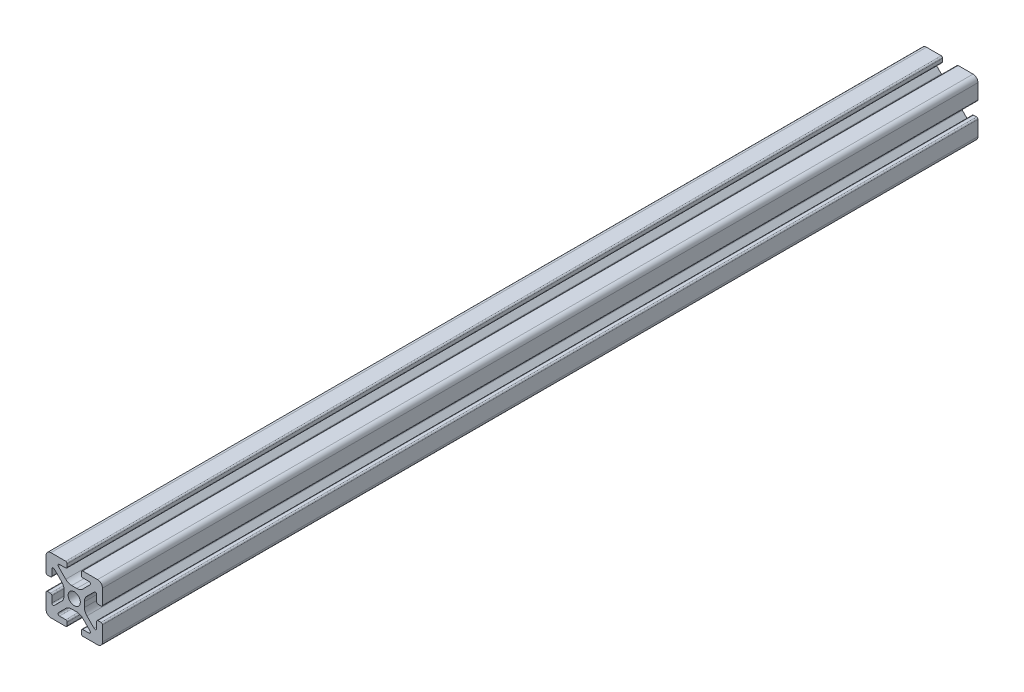
from build123d import *

# Parameters (mm, degrees)
BOSS_EXTRUDE1_DEPTH = 155


with BuildPart() as part:
    # Sketch4 → Boss-Extrude1 (new, symmetric)
    with BuildSketch(Plane.XY):
        with BuildLine():
            Line((3, -10), (8.25, -10))
            ThreePointArc((8.25, -10), (9.487436867, -9.487436867), (10, -8.25))
            Line((10, -8.25), (10, -3))
            ThreePointArc((10, -3), (9.853553391, -2.646446609), (9.5, -2.5))
            Line((9.5, -2.5), (8.424621202, -2.5))
            ThreePointArc((8.424621202, -2.5), (8.071067812, -2.646446609), (7.924621202, -3))
            Line((7.924621202, -3), (7.924621202, -5.25))
            ThreePointArc((7.924621202, -5.25), (7.615962919, -5.711939766), (7.071067812, -5.603553391))
            Line((7.071067812, -5.603553391), (4.478679656, -3.011165235))
            ThreePointArc((4.478679656, -3.011165235), (3.828361402, -2.037895189), (3.6, -0.889844892))
            Line((3.6, -0.889844892), (3.6, 0))
            Line((3.6, 0), (2.15, 0))
            ThreePointArc((2.15, 0), (1.52027958, -1.52027958), (0, -2.15))
            Line((0, -2.15), (0, -3.6))
            Line((0, -3.6), (0.889844892, -3.6))
            ThreePointArc((0.889844892, -3.6), (2.037895189, -3.828361402), (3.011165235, -4.478679656))
            Line((3.011165235, -4.478679656), (5.603553391, -7.071067812))
            ThreePointArc((5.603553391, -7.071067812), (5.711939766, -7.615962919), (5.25, -7.924621202))
            Line((5.25, -7.924621202), (3, -7.924621202))
            ThreePointArc((3, -7.924621202), (2.646446609, -8.071067812), (2.5, -8.424621202))
            Line((2.5, -8.424621202), (2.5, -9.5))
            ThreePointArc((2.5, -9.5), (2.646446609, -9.853553391), (3, -10))
        make_face()
    extrude(amount=BOSS_EXTRUDE1_DEPTH, both=True)

    # Mirror1: part across plane


with BuildPart() as part_1:
    add(part.part)
    add(part.part.mirror(Plane(origin=(0, 0, 0), x_dir=(0, 0, 1), z_dir=(1, 0, 0))))

    # Mirror2: part across plane


with BuildPart() as part_2:
    add(part_1.part)
    add(part_1.part.mirror(Plane.ZX))


solid = part_2.part
